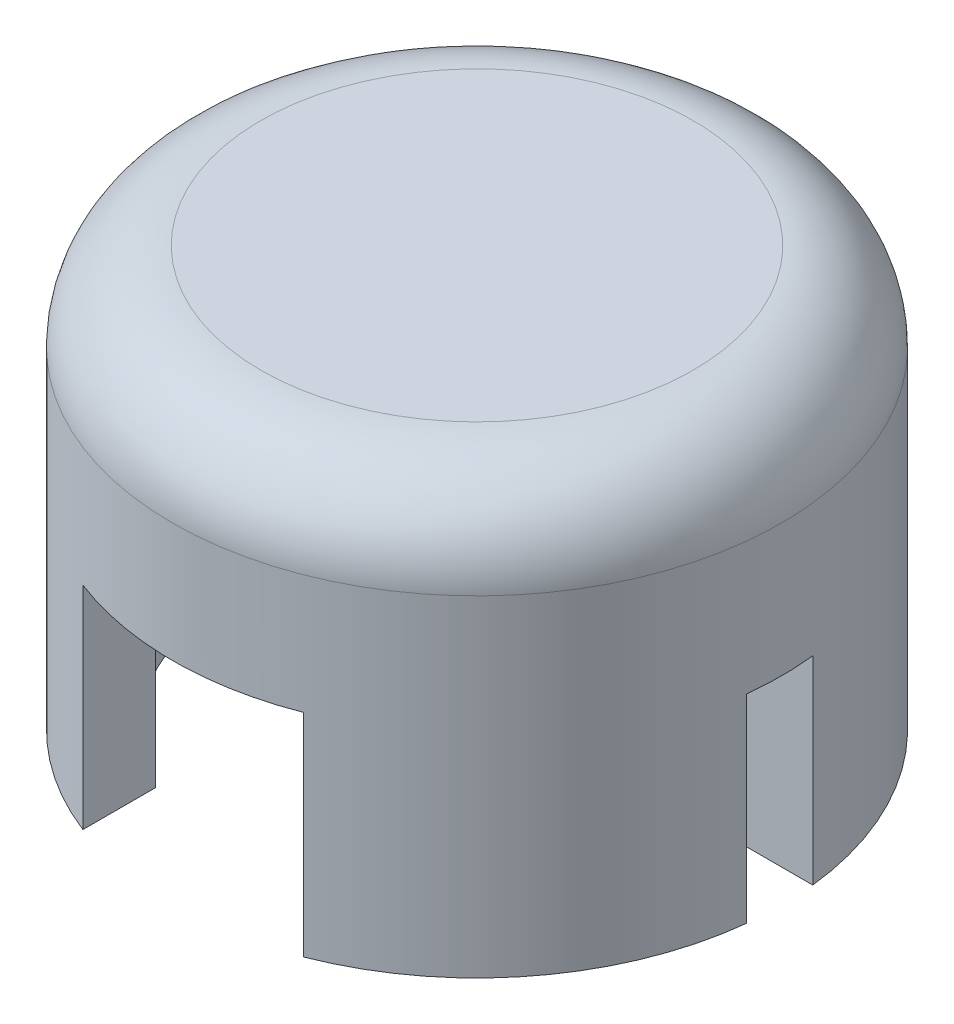
from build123d import *

# Parameters (mm, degrees)
SKETCH1_R               = 6.9
SKETCH1_R_2             = 5.4
BOSS_EXTRUDE1_DEPTH     = 7.3
SKETCH2_R               = 6.9
BOSS_EXTRUDE2_DEPTH     = 2.2
FILLET1_R               = 2
SKETCH6_W               = 1.1
SKETCH6_H               = 1
SKETCH4_W               = 5
SKETCH4_H               = 4.8
CUT_EXTRUDE1_DEPTH      = 14.618737093
CUT_EXTRUDE2_DEPTH      = 14.618737093
CUT_EXTRUDE2_DEPTH_BACK = 14.618737093
SKETCH5_W               = 1.5
SKETCH5_H               = 4.5
SKETCH3_R               = 3
BOSS_EXTRUDE3_DEPTH     = 3


with BuildPart() as part:
    # Sketch1 → Boss-Extrude1 (new body)
    with BuildSketch(Plane(origin=(0, 0, 0), x_dir=(1, 0, 0), z_dir=(0, 1, 0))):
        with Locations(Location((0, 0, 0), (0, 0, 270))):
            Circle(SKETCH1_R)
        with Locations(Location((0, 0, 0), (0, 0, 270))):
            Circle(SKETCH1_R_2, mode=Mode.SUBTRACT)
    extrude(amount=BOSS_EXTRUDE1_DEPTH)

    # Sketch2 → Boss-Extrude2 (add)
    with BuildSketch(Plane(origin=(0, 7.3, 0), x_dir=(1, 0, 0), z_dir=(0, 1, 0))):
        with Locations(Location((0, 0, 0), (0, 0, 270))):
            Circle(SKETCH2_R)
    extrude(amount=BOSS_EXTRUDE2_DEPTH)

    # Fillet1
    fillet1_edges = [part.edges().sort_by_distance(p)[0] for p in [
        (0, 9.5, -6.9),
    ]]
    fillet(fillet1_edges, radius=FILLET1_R)

    # Sketch6 → Revolve3 (revolve)
    with BuildSketch(Plane.XY, mode=Mode.PRIVATE) as revolve3_sk:
        with Locations((4.95, 4.3)):
            Rectangle(SKETCH6_W, SKETCH6_H)
    revolve(revolve3_sk.sketch.rotate(Axis((0, 9.975, 0), (0, -1, 0)), 90), axis=Axis((0, 9.975, 0), (0, -1, 0)))

    # Sketch4 → Cut-Extrude1 (cut, through all)
    with BuildSketch(Plane.XY):
        with Locations((0, 2.4)):
            Rectangle(SKETCH4_W, SKETCH4_H)
    extrude(amount=CUT_EXTRUDE1_DEPTH, mode=Mode.SUBTRACT)

    # Sketch5 → Cut-Extrude2 (cut, two sides: drawn at the far end of the back side and taken through both)
    with BuildSketch(Plane(origin=(0, 0, 0), x_dir=(0, 0, -1), z_dir=(1, 0, 0)).offset(-CUT_EXTRUDE2_DEPTH_BACK)):
        with Locations((0, 2.25)):
            Rectangle(SKETCH5_W, SKETCH5_H)
    extrude(amount=CUT_EXTRUDE2_DEPTH + CUT_EXTRUDE2_DEPTH_BACK, mode=Mode.SUBTRACT)

    # Sketch3 → Boss-Extrude3 (add)
    with BuildSketch(Plane.XZ.offset(-7.3)):
        with Locations(Location((0, 0, 0), (0, 0, 90))):
            Circle(SKETCH3_R)
    extrude(amount=BOSS_EXTRUDE3_DEPTH)


solid = part.part
